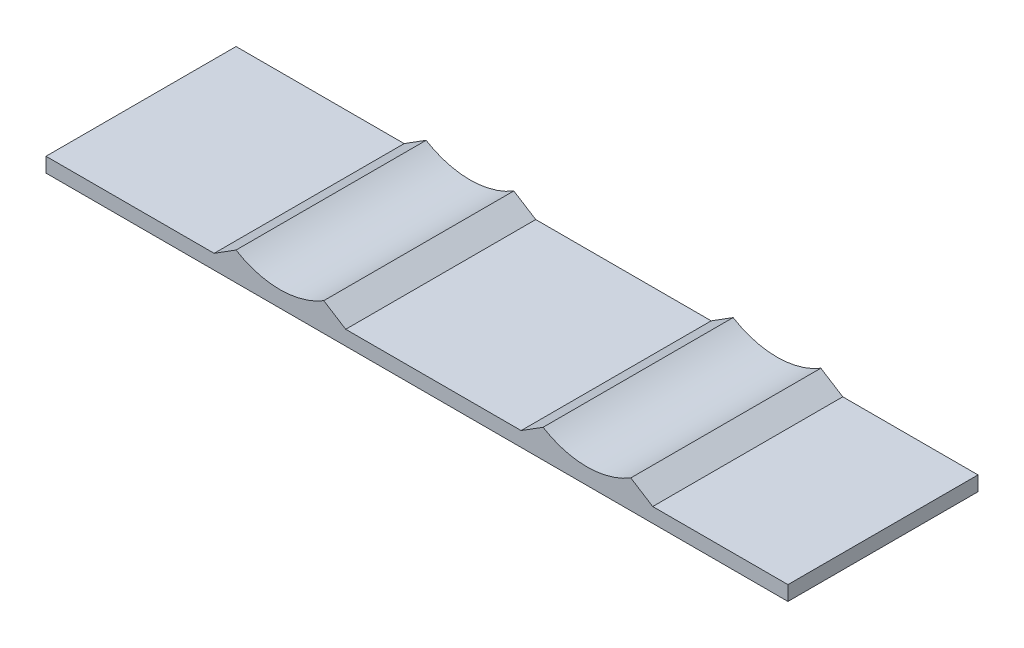
from build123d import *

# Parameters (mm, degrees)
BOSS_EXTRUDE1_DEPTH = 26


with BuildPart() as part:
    # Sketch1 → Boss-Extrude1 (new body)
    with BuildSketch(Plane.XY):
        with BuildLine():
            Line((0, 0), (101.5, 0))
            Line((101.5, 0), (101.5, 2))
            Line((101.5, 2), (83, 2))
            Line((83, 2), (80, 3.889291565))
            ThreePointArc((80, 3.889291565), (74, 2.2), (68, 3.889291565))
            Line((68, 3.889291565), (65, 2))
            Line((65, 2), (41, 2))
            Line((41, 2), (38, 3.889291565))
            ThreePointArc((38, 3.889291565), (32, 2.2), (26, 3.889291565))
            Line((26, 3.889291565), (23, 2))
            Line((23, 2), (0, 2))
            Line((0, 2), (0, 0))
        make_face()
    extrude(amount=BOSS_EXTRUDE1_DEPTH)


solid = part.part
